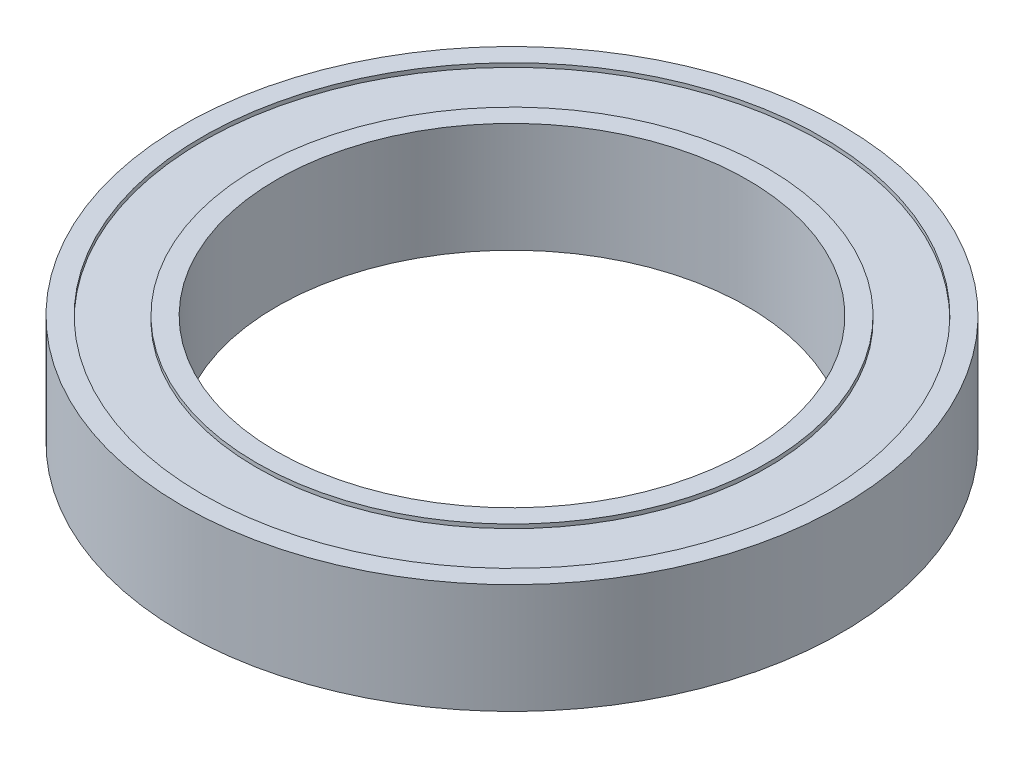
from build123d import *

# Parameters (mm, degrees)
SKETCH1_R           = 21
SKETCH1_R_2         = 15
BOSS_EXTRUDE1_DEPTH = 7
SKETCH2_R           = 19.73
SKETCH2_R_2         = 16.27
CUT_EXTRUDE1_DEPTH  = 0.254


with BuildPart() as part:
    # Sketch1 → Boss-Extrude1 (new body)
    with BuildSketch(Plane(origin=(0, 0, 0), x_dir=(1, 0, 0), z_dir=(0, 1, 0))):
        with Locations(Location((0, 0, 0), (0, 0, 270))):
            Circle(SKETCH1_R)
        with Locations(Location((0, 0, 0), (0, 0, 270))):
            Circle(SKETCH1_R_2, mode=Mode.SUBTRACT)
    extrude(amount=BOSS_EXTRUDE1_DEPTH)

    # Sketch2 → Cut-Extrude1 (cut)
    with BuildSketch(Plane(origin=(0, 7, 0), x_dir=(1, 0, 0), z_dir=(0, 1, 0))):
        with Locations(Location((0, 0, 0), (0, 0, 270))):
            Circle(SKETCH2_R)
        with Locations(Location((0, 0, 0), (0, 0, 270))):
            Circle(SKETCH2_R_2, mode=Mode.SUBTRACT)
    cut_extrude1 = extrude(amount=-CUT_EXTRUDE1_DEPTH, mode=Mode.SUBTRACT)

    # Mirror1: Cut-Extrude1 across plane
    add(cut_extrude1.mirror(Plane(origin=(0, 3.5, 0), x_dir=(0, 0, 1), z_dir=(0, -1, 0))), mode=Mode.SUBTRACT)


solid = part.part
